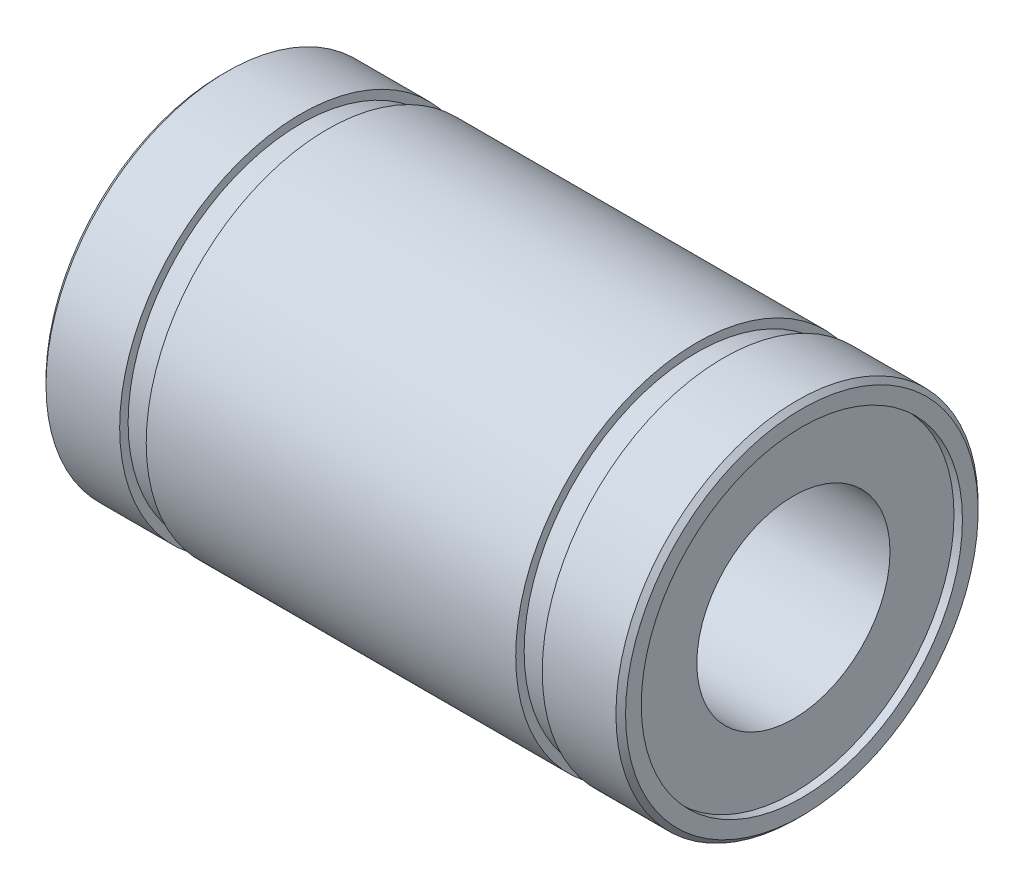
from build123d import *

# Parameters (mm, degrees)
CHAMFER1_SIZE = 0.2


with BuildPart() as part:
    # Sketch1 → Revolve1 (revolve)
    with BuildSketch(Plane.XY, mode=Mode.PRIVATE) as revolve1_sk:
        Polygon((0.35, 4), (0.35, 6.65), (0, 6.65), (0, 7.5), (3.25, 7.5), (3.25, 7.15), (4.35, 7.15), (4.35, 7.5), (19.65, 7.5), (19.65, 7.15), (20.75, 7.15), (20.75, 7.5), (24, 7.5), (24, 6.65), (23.65, 6.65), (23.65, 4), align=None)
    revolve(revolve1_sk.sketch.rotate(Axis((0, 0, 0), (1, 0, 0)), 90), axis=Axis((0, 0, 0), (1, 0, 0)))

    # Chamfer1
    chamfer1_edges = [part.edges().sort_by_distance(p)[0] for p in [
        (24, 0, -7.5),
        (0, 0, -7.5),
    ]]
    chamfer(chamfer1_edges, length=CHAMFER1_SIZE)


solid = part.part
